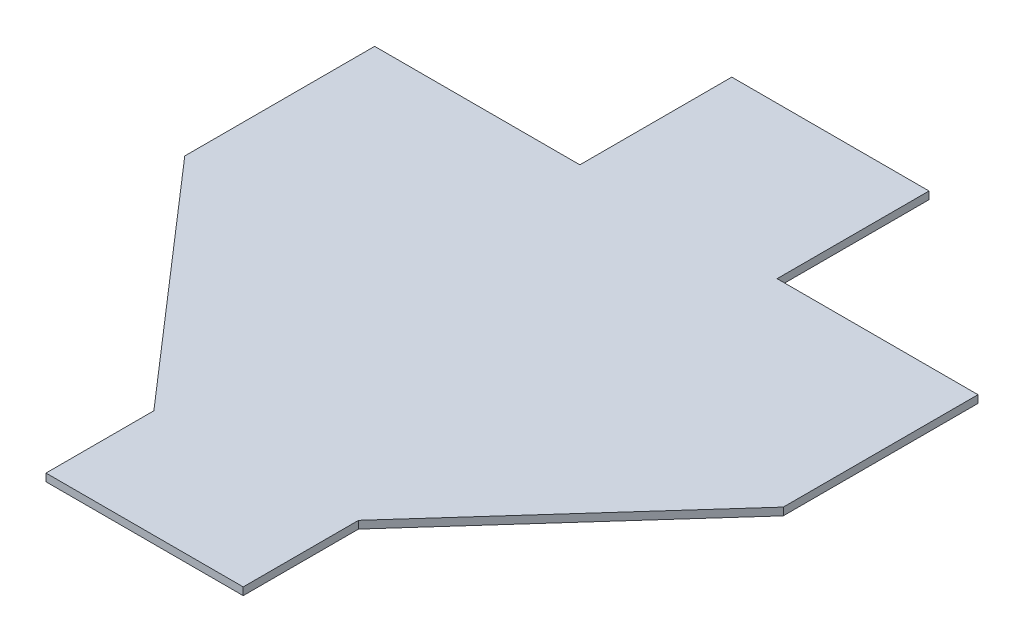
from build123d import *

# Parameters (mm, degrees)
BOSS_EXTRUDE1_DEPTH = 1
BOSS_EXTRUDE2_DEPTH = 1


with BuildPart() as part:
    # Sketch1 → Boss-Extrude1 (new body)
    with BuildSketch(Plane(origin=(0, 0, 0), x_dir=(1, 0, 0), z_dir=(0, 1, 0))):
        Polygon((-17.101249567, 62.026712282), (-17.101249567, 42.026712282), (-44.119439114, 42.026712282), (-44.119439114, 17.026712282), (-4.760262303, -28.259656537), (35.313890805, 16.395267634), (35.313890805, 42.026712282), (8.862371339, 42.026712282), (8.862371339, 62.026712282), align=None)
    extrude(amount=BOSS_EXTRUDE1_DEPTH)

    # Sketch2 → Boss-Extrude2 (add)
    with BuildSketch(Plane(origin=(0, 1, 0), x_dir=(1, 0, 0), z_dir=(0, 1, 0))):
        Polygon((8.862371339, -28.259656537), (-17.101249567, -28.259656537), (-17.101249567, 42.026712282), (8.862371339, 62.026712282), align=None)
    extrude(amount=-BOSS_EXTRUDE2_DEPTH)


solid = part.part
